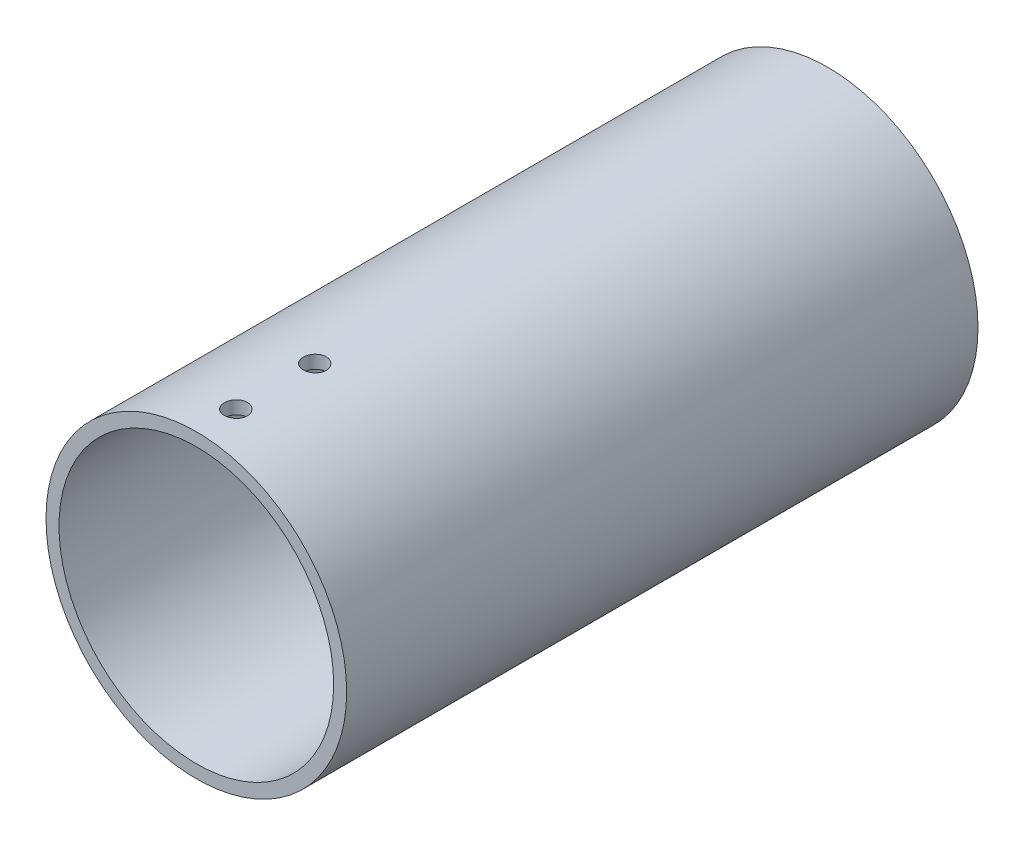
from build123d import *

# Parameters (mm, degrees)
SKETCH1_R           = 19.05
SKETCH1_R_2         = 17.4
BOSS_EXTRUDE1_DEPTH = 80
CUT_EXTRUDE1_START  = 15
SKETCH2_R           = 1.45
CUT_EXTRUDE1_DEPTH  = 5


with BuildPart() as part:
    # Sketch1 → Boss-Extrude1 (new body)
    with BuildSketch(Plane.XY):
        Circle(SKETCH1_R)
        Circle(SKETCH1_R_2, mode=Mode.SUBTRACT)
    extrude(amount=BOSS_EXTRUDE1_DEPTH)

    # Sketch2 → Cut-Extrude1 (cut)
    with BuildSketch(Plane(origin=(0, 0, 0), x_dir=(1, 0, 0), z_dir=(0, 1, 0)).offset(CUT_EXTRUDE1_START)):
        with Locations(Location((0, -75, 0), (0, 0, 90))):
            Circle(SKETCH2_R)
        with Locations(Location((0, -65, 0), (0, 0, 90))):
            Circle(SKETCH2_R)
    extrude(amount=CUT_EXTRUDE1_DEPTH, mode=Mode.SUBTRACT)


solid = part.part
